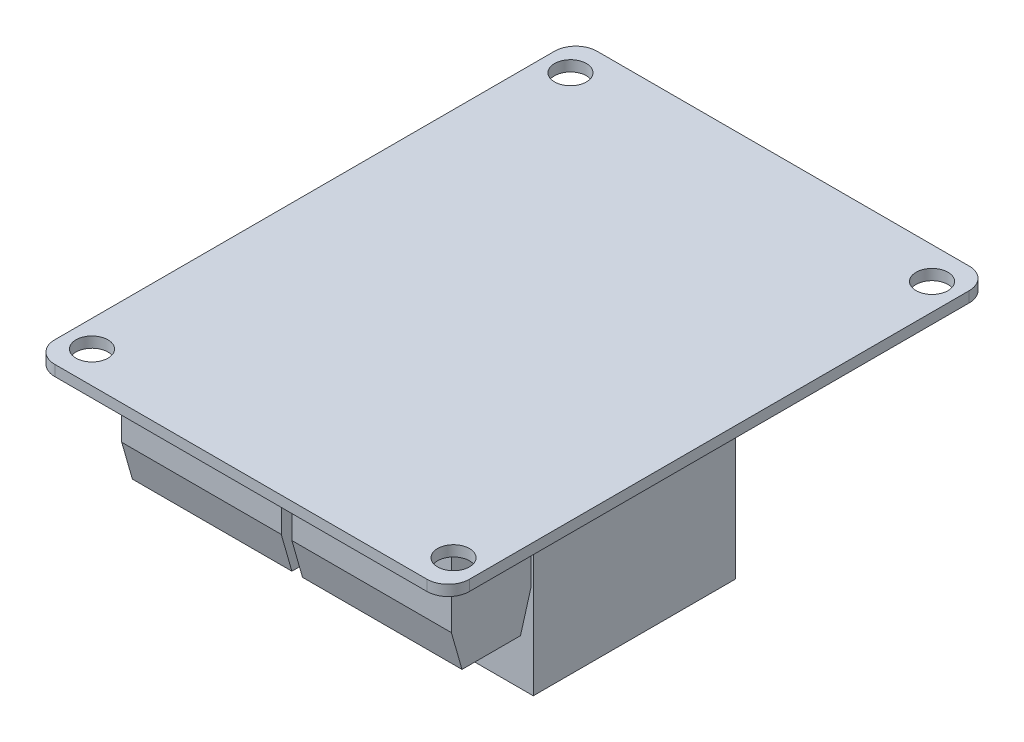
from build123d import *

# Parameters (mm, degrees)
SKETCH1_W               = 39
SKETCH1_H               = 51
BOSS_EXTRUDE1_DEPTH     = 1
SKETCH2_R               = 1.5
CUT_EXTRUDE1_DEPTH      = 33.116973706
FILLET1_R               = 2
SKETCH3_W               = 15
SKETCH3_H               = 19
BOSS_EXTRUDE2_DEPTH     = 15.5
SKETCH4_W               = 15
SKETCH4_H               = 7.5
BOSS_EXTRUDE3_DEPTH     = 10
CUT_EXTRUDE2_DEPTH      = 36.647580563
CUT_EXTRUDE2_DEPTH_BACK = 36.647580563
SKETCH6_W               = 7.62
SKETCH6_H               = 2.54
SKETCH6_W_2             = 10.16
BOSS_EXTRUDE4_DEPTH     = 2
SKETCH7_W               = 0.5
SKETCH7_H               = 0.5
BOSS_EXTRUDE5_DEPTH     = 6


with BuildPart() as part:
    # Sketch1 → Boss-Extrude1 (new body)
    with BuildSketch(Plane(origin=(0, 0, 0), x_dir=(1, 0, 0), z_dir=(0, 1, 0))):
        Rectangle(SKETCH1_W, SKETCH1_H)
    extrude(amount=BOSS_EXTRUDE1_DEPTH)

    # Sketch2 → Cut-Extrude1 (cut, through all)
    with BuildSketch(Plane(origin=(0, 1, 0), x_dir=(1, 0, 0), z_dir=(0, 1, 0))):
        with Locations(Location((-17, 22.5, 0), (0, 0, 270))):
            Circle(SKETCH2_R)
        with Locations(Location((17, 22.5, 0), (0, 0, 90))):
            Circle(SKETCH2_R)
        with Locations(Location((17, -22.5, 0), (0, 0, 270))):
            Circle(SKETCH2_R)
        with Locations(Location((-17, -22.5, 0), (0, 0, 90))):
            Circle(SKETCH2_R)
    extrude(amount=-CUT_EXTRUDE1_DEPTH, mode=Mode.SUBTRACT)

    # Fillet1
    fillet1_edges = [part.edges().sort_by_distance(p)[0] for p in [
        (19.5, 0.5, 25.5),
        (-19.5, 0.5, 25.5),
        (-19.5, 0.5, -25.5),
        (19.5, 0.5, -25.5),
    ]]
    fillet(fillet1_edges, radius=FILLET1_R)

    # Sketch3 → Boss-Extrude2 (add)
    with BuildSketch(Plane.XZ):
        with Locations((-8, 4)):
            Rectangle(SKETCH3_W, SKETCH3_H)
        with Locations((8, 4)):
            Rectangle(SKETCH3_W, SKETCH3_H)
    extrude(amount=BOSS_EXTRUDE2_DEPTH)

    # Sketch4 → Boss-Extrude3 (add)
    with BuildSketch(Plane.XZ):
        with Locations((-8, 17.45)):
            Rectangle(SKETCH4_W, SKETCH4_H)
        with Locations((8, 17.45)):
            Rectangle(SKETCH4_W, SKETCH4_H)
    extrude(amount=BOSS_EXTRUDE3_DEPTH)

    # Sketch5 → Cut-Extrude2 (cut, two sides: drawn at the far end of the back side and taken through both)
    with BuildSketch(Plane(origin=(0, 0, 0), x_dir=(0, 0, -1), z_dir=(1, 0, 0)).offset(-CUT_EXTRUDE2_DEPTH_BACK)):
        Polygon((-21.2, -10), (-21.2, -6.5), (-20.2, -10), align=None)
        Polygon((-14.7, -10), (-13.7, -10), (-13.7, -6.5), align=None)
    extrude(amount=CUT_EXTRUDE2_DEPTH + CUT_EXTRUDE2_DEPTH_BACK, mode=Mode.SUBTRACT)

    # Sketch6 → Boss-Extrude4 (add)
    with BuildSketch(Plane.XZ):
        with Locations((-7.69, -22.23)):
            Rectangle(SKETCH6_W, SKETCH6_H)
        with Locations((6.42, -22.23)):
            Rectangle(SKETCH6_W_2, SKETCH6_H)
    extrude(amount=BOSS_EXTRUDE4_DEPTH)

    # Sketch7 → Boss-Extrude5 (add)
    with BuildSketch(Plane.XZ.offset(2)):
        with Locations((7.69, -22.23)):
            Rectangle(SKETCH7_W, SKETCH7_H)
        with Locations((10.23, -22.23)):
            Rectangle(SKETCH7_W, SKETCH7_H)
        with Locations((5.15, -22.23)):
            Rectangle(SKETCH7_W, SKETCH7_H)
        with Locations((2.61, -22.23)):
            Rectangle(SKETCH7_W, SKETCH7_H)
        with Locations((-5.15, -22.23)):
            Rectangle(SKETCH7_W, SKETCH7_H)
        with Locations((-7.69, -22.23)):
            Rectangle(SKETCH7_W, SKETCH7_H)
        with Locations((-10.23, -22.23)):
            Rectangle(SKETCH7_W, SKETCH7_H)
    extrude(amount=BOSS_EXTRUDE5_DEPTH)


solid = part.part
